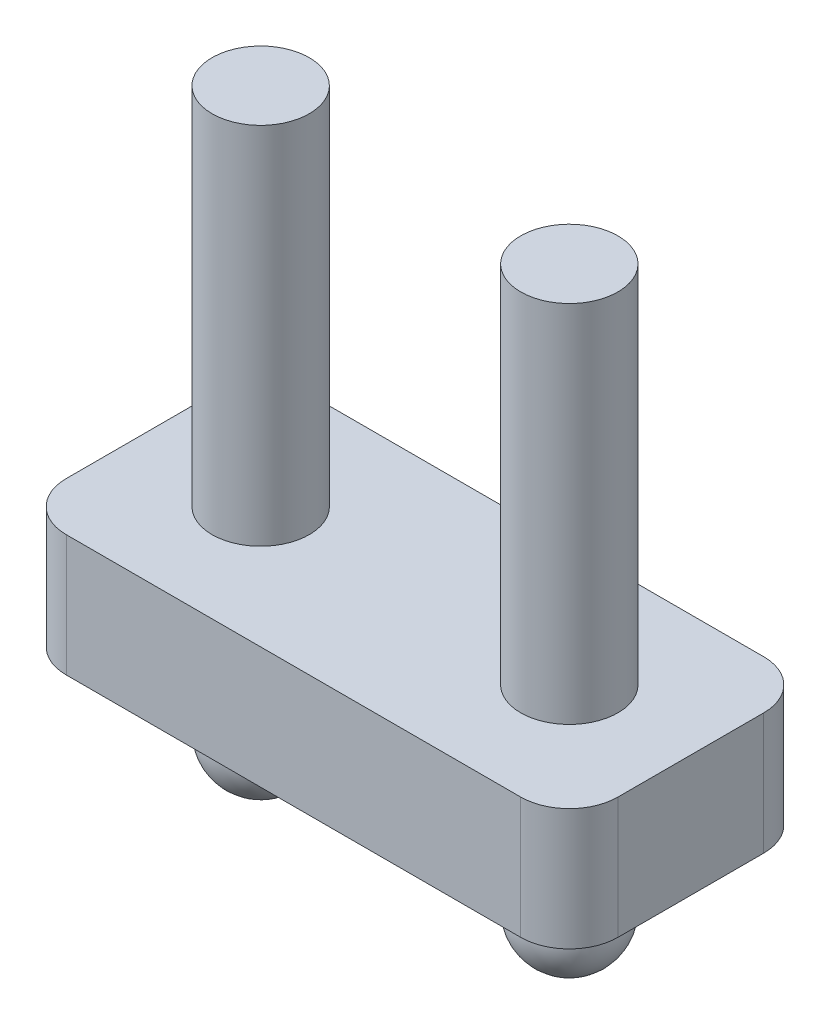
from build123d import *

# Parameters (mm, degrees)
SKETCH1_W                = 4.54
SKETCH1_H                = 2
SKETCH1_R                = 0.4
BOSS_EXTRUDE1_DEPTH      = 1
FILLET2_R                = 0.4
BOSS_EXTRUDE2_DEPTH      = 3
BOSS_EXTRUDE2_DEPTH_BACK = 2
SKETCH2_R                = 0.4
FILLET1_R                = 0.4


with BuildPart() as part:
    # Sketch1 → Boss-Extrude1 (new body)
    with BuildSketch(Plane(origin=(0, 0, 0), x_dir=(1, 0, 0), z_dir=(0, 1, 0))):
        with Locations((2.27, 1)):
            Rectangle(SKETCH1_W, SKETCH1_H)
        with Locations(Location((1, 1, 0), (0, 0, 270))):
            Circle(SKETCH1_R, mode=Mode.SUBTRACT)
        with Locations(Location((3.54, 1, 0), (0, 0, 270))):
            Circle(SKETCH1_R, mode=Mode.SUBTRACT)
    extrude(amount=BOSS_EXTRUDE1_DEPTH)

    # Fillet2
    fillet2_edges = [part.edges().sort_by_distance(p)[0] for p in [
        (0, 0.5, -2),
        (4.54, 0.5, -2),
        (4.54, 0.5, 0),
        (0, 0.5, 0),
    ]]
    fillet(fillet2_edges, radius=FILLET2_R)

    # Sketch2 → Boss-Extrude2 (add, two sides: drawn at the far end of the back side and taken through both)
    with BuildSketch(Plane(origin=(0, 1, 0), x_dir=(1, 0, 0), z_dir=(0, 1, 0)).offset(-BOSS_EXTRUDE2_DEPTH_BACK)):
        with Locations(Location((1, 1, 0), (0, 0, 270))):
            Circle(SKETCH2_R)
        with Locations(Location((3.54, 1, 0), (0, 0, 270))):
            Circle(SKETCH2_R)
    extrude(amount=BOSS_EXTRUDE2_DEPTH + BOSS_EXTRUDE2_DEPTH_BACK)

    # Fillet1
    fillet1_edges = [part.edges().sort_by_distance(p)[0] for p in [
        (1, -1, -1.4),
        (3.54, -1, -1.4),
    ]]
    fillet(fillet1_edges, radius=FILLET1_R)


solid = part.part
